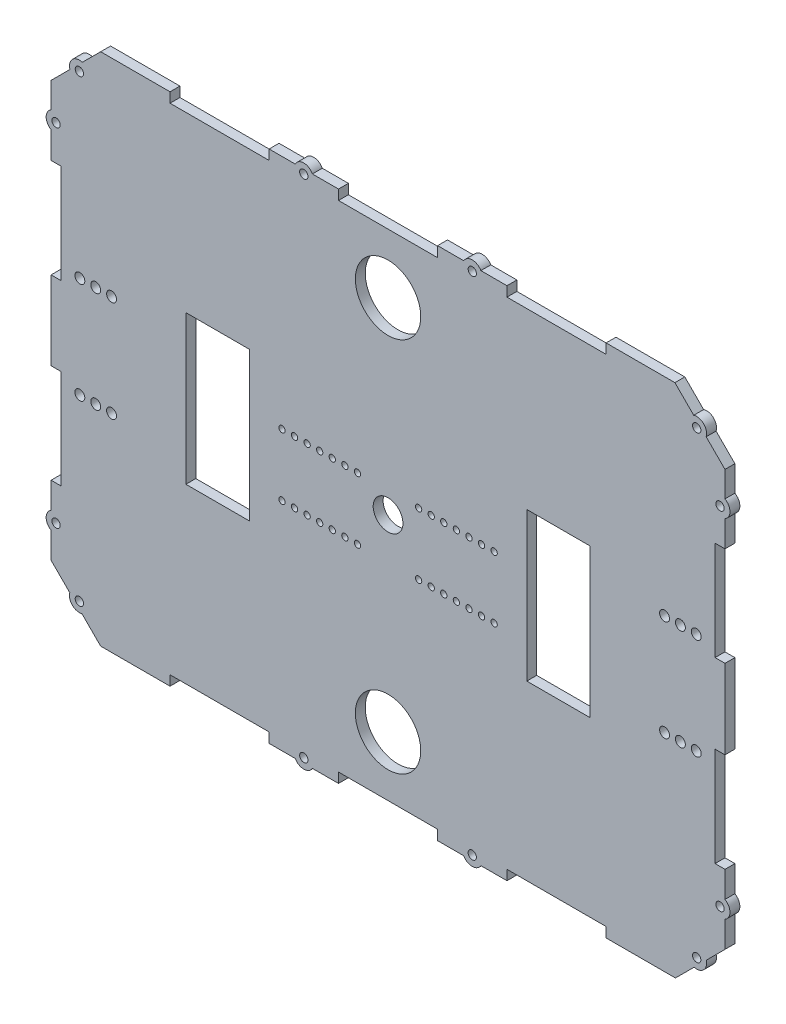
from build123d import *

# Parameters (mm, degrees)
ESQUISSE1_R        = 2.1
ESQUISSE1_R_2      = 2.5
ESQUISSE1_R_3      = 16.5
ESQUISSE1_R_4      = 7.5
ESQUISSE1_R_5      = 1.5875
ESQUISSE1_W        = 32
ESQUISSE1_H        = 75
BOSS_EXTRU_1_DEPTH = 5


with BuildPart() as part:
    # Esquisse1 → Boss.-Extru.1 (new body)
    with BuildSketch(Plane.XY):
        with BuildLine():
            Line((0, 0), (35, 0))
            Line((35, 0), (35, -5))
            Line((35, -5), (85, -5))
            Line((85, -5), (85, 0))
            Line((85, 0), (98.169872981, 0))
            ThreePointArc((98.169872981, 0), (102.5, 2.641471856), (106.830127019, 0))
            Line((106.830127019, 0), (120, 0))
            Line((120, 0), (120, -5))
            Line((120, -5), (170, -5))
            Line((170, -5), (170, 0.271578296))
            Line((170, 0.271578296), (183.169872981, 0.271578296))
            ThreePointArc((183.169872981, 0.271578296), (187.5, 2.771578296), (191.830127019, 0.271578296))
            Line((191.830127019, 0.271578296), (205, 0.271578296))
            Line((205, 0.271578296), (205, -4.728421704))
            Line((205, -4.728421704), (255, -4.728421704))
            Line((255, -4.728421704), (255, 0.271578296))
            Line((255, 0.271578296), (289.728421704, 0.271578296))
            Line((289.728421704, 0.271578296), (299.227867688, -9.227867688))
            ThreePointArc((299.227867688, -9.227867688), (304.267766953, -10.460654751), (305.500554016, -15.500554016))
            Line((305.500554016, -15.500554016), (315, -25))
            Line((315, -25), (315, -37.898294686))
            ThreePointArc((315, -37.898294686), (317.5, -42.228421704), (315, -46.558548723))
            Line((315, -46.558548723), (315, -59.728421704))
            Line((315, -59.728421704), (310, -59.728421704))
            Line((310, -59.728421704), (310, -109.728421704))
            Line((310, -109.728421704), (315, -109.728421704))
            Line((315, -109.728421704), (315, -149.728421704))
            Line((315, -149.728421704), (310, -149.728421704))
            Line((310, -149.728421704), (310, -199.728421704))
            Line((310, -199.728421704), (315, -199.728421704))
            Line((315, -199.728421704), (315, -212.898294686))
            ThreePointArc((315, -212.898294686), (317.5, -217.228421704), (315, -221.558548723))
            Line((315, -221.558548723), (315, -234.728421704))
            Line((315, -234.728421704), (305.561862178, -244.166559526))
            ThreePointArc((305.561862178, -244.166559526), (304.267766953, -248.996188657), (299.438137822, -250.290283883))
            Line((299.438137822, -250.290283883), (290, -259.728421704))
            Line((290, -259.728421704), (255, -259.728421704))
            Line((255, -259.728421704), (255, -254.728421704))
            Line((255, -254.728421704), (205, -254.728421704))
            Line((205, -254.728421704), (205, -259.728421704))
            Line((205, -259.728421704), (191.830127019, -259.728421704))
            ThreePointArc((191.830127019, -259.728421704), (187.5, -262.228421704), (183.169872981, -259.728421704))
            Line((183.169872981, -259.728421704), (170, -259.728421704))
            Line((170, -259.728421704), (170, -254.728421704))
            Line((170, -254.728421704), (120, -254.728421704))
            Line((120, -254.728421704), (120, -259.728421704))
            Line((120, -259.728421704), (106.830127019, -259.728421704))
            ThreePointArc((106.830127019, -259.728421704), (102.5, -262.228421704), (98.169872981, -259.728421704))
            Line((98.169872981, -259.728421704), (85, -259.728421704))
            Line((85, -259.728421704), (85, -254.728421704))
            Line((85, -254.728421704), (35, -254.728421704))
            Line((35, -254.728421704), (35, -259.728421704))
            Line((35, -259.728421704), (0, -259.728421704))
            Line((0, -259.728421704), (-9.438137822, -250.290283883))
            ThreePointArc((-9.438137822, -250.290283883), (-14.267766953, -248.996188657), (-15.561862178, -244.166559526))
            Line((-15.561862178, -244.166559526), (-25, -234.728421704))
            Line((-25, -234.728421704), (-25, -221.558548723))
            ThreePointArc((-25, -221.558548723), (-27.5, -217.228421704), (-25, -212.898294686))
            Line((-25, -212.898294686), (-25, -199.728421704))
            Line((-25, -199.728421704), (-20, -199.728421704))
            Line((-20, -199.728421704), (-20, -149.728421704))
            Line((-20, -149.728421704), (-25, -149.728421704))
            Line((-25, -149.728421704), (-25, -110))
            Line((-25, -110), (-20, -110))
            Line((-20, -110), (-20, -60))
            Line((-20, -60), (-25, -60))
            Line((-25, -60), (-25, -46.558548723))
            ThreePointArc((-25, -46.558548723), (-27.5, -42.228421704), (-25, -37.898294686))
            Line((-25, -37.898294686), (-25, -25))
            Line((-25, -25), (-15.500554016, -15.500554016))
            ThreePointArc((-15.500554016, -15.500554016), (-14.267766953, -10.460654751), (-9.227867688, -9.227867688))
            Line((-9.227867688, -9.227867688), (0, 0))
        make_face()
        with Locations((102.5, -257.228421704)):
            Circle(ESQUISSE1_R, mode=Mode.SUBTRACT)
        with Locations(Location((187.5, -257.228421704, 0), (0, 0, 180))):
            Circle(ESQUISSE1_R, mode=Mode.SUBTRACT)
        with Locations(Location((102.5, -2.228421704, 0), (0, 0, 180))):
            Circle(ESQUISSE1_R, mode=Mode.SUBTRACT)
        with Locations((187.5, -2.228421704)):
            Circle(ESQUISSE1_R, mode=Mode.SUBTRACT)
        with Locations((-10.732233047, -13.996188657)):
            Circle(ESQUISSE1_R, mode=Mode.SUBTRACT)
        with Locations(Location((300.732233047, -13.996188657, 0), (0, 0, 180))):
            Circle(ESQUISSE1_R, mode=Mode.SUBTRACT)
        with Locations((300.732233047, -245.460654751)):
            Circle(ESQUISSE1_R, mode=Mode.SUBTRACT)
        with Locations(Location((-10.732233047, -245.460654751, 0), (0, 0, 180))):
            Circle(ESQUISSE1_R, mode=Mode.SUBTRACT)
        with Locations((-22.5, -217.228421704)):
            Circle(ESQUISSE1_R, mode=Mode.SUBTRACT)
        with Locations(Location((-22.5, -42.228421704, 0), (0, 0, 180))):
            Circle(ESQUISSE1_R, mode=Mode.SUBTRACT)
        with Locations((312.5, -42.228421704)):
            Circle(ESQUISSE1_R, mode=Mode.SUBTRACT)
        with Locations(Location((312.5, -217.228421704, 0), (0, 0, 180))):
            Circle(ESQUISSE1_R, mode=Mode.SUBTRACT)
        with Locations(Location((300.5, -155.228421704, 0), (0, 0, 180))):
            Circle(ESQUISSE1_R_2, mode=Mode.SUBTRACT)
        with Locations(Location((300.5, -104.228421704, 0), (0, 0, 180))):
            Circle(ESQUISSE1_R_2, mode=Mode.SUBTRACT)
        with Locations((145, -35)):
            Circle(ESQUISSE1_R_3, mode=Mode.SUBTRACT)
        with Locations((145, -129.864210852)):
            Circle(ESQUISSE1_R_4, mode=Mode.SUBTRACT)
        with Locations(Location((292.5, -104.228421704, 0), (0, 0, 180))):
            Circle(ESQUISSE1_R_2, mode=Mode.SUBTRACT)
        with Locations(Location((292.5, -155.228421704, 0), (0, 0, 180))):
            Circle(ESQUISSE1_R_2, mode=Mode.SUBTRACT)
        with Locations(Location((284.5, -104.228421704, 0), (0, 0, 180))):
            Circle(ESQUISSE1_R_2, mode=Mode.SUBTRACT)
        with Locations(Location((284.5, -155.228421704, 0), (0, 0, 180))):
            Circle(ESQUISSE1_R_2, mode=Mode.SUBTRACT)
        with Locations((-10.5, -104.228421704)):
            Circle(ESQUISSE1_R_2, mode=Mode.SUBTRACT)
        with Locations((-2.5, -104.228421704)):
            Circle(ESQUISSE1_R_2, mode=Mode.SUBTRACT)
        with Locations((5.5, -104.228421704)):
            Circle(ESQUISSE1_R_2, mode=Mode.SUBTRACT)
        with Locations((-10.5, -155.228421704)):
            Circle(ESQUISSE1_R_2, mode=Mode.SUBTRACT)
        with Locations((-2.5, -155.228421704)):
            Circle(ESQUISSE1_R_2, mode=Mode.SUBTRACT)
        with Locations((5.5, -155.228421704)):
            Circle(ESQUISSE1_R_2, mode=Mode.SUBTRACT)
        with Locations(Location((145, -224.728421704, 0), (0, 0, 180))):
            Circle(ESQUISSE1_R_3, mode=Mode.SUBTRACT)
        with Locations((91.471682341, -119.185385667)):
            Circle(ESQUISSE1_R_5, mode=Mode.SUBTRACT)
        with Locations((104.171682341, -119.185385667)):
            Circle(ESQUISSE1_R_5, mode=Mode.SUBTRACT)
        with Locations((97.821682341, -119.185385667)):
            Circle(ESQUISSE1_R_5, mode=Mode.SUBTRACT)
        with Locations((110.521682341, -119.185385667)):
            Circle(ESQUISSE1_R_5, mode=Mode.SUBTRACT)
        with Locations((116.871682341, -119.185385667)):
            Circle(ESQUISSE1_R_5, mode=Mode.SUBTRACT)
        with Locations((129.571682341, -119.185385667)):
            Circle(ESQUISSE1_R_5, mode=Mode.SUBTRACT)
        with Locations((123.221682341, -119.185385667)):
            Circle(ESQUISSE1_R_5, mode=Mode.SUBTRACT)
        with Locations((129.571682341, -150.427385667)):
            Circle(ESQUISSE1_R_5, mode=Mode.SUBTRACT)
        with Locations((123.221682341, -150.427385667)):
            Circle(ESQUISSE1_R_5, mode=Mode.SUBTRACT)
        with Locations((116.871682341, -150.427385667)):
            Circle(ESQUISSE1_R_5, mode=Mode.SUBTRACT)
        with Locations((110.521682341, -150.427385667)):
            Circle(ESQUISSE1_R_5, mode=Mode.SUBTRACT)
        with Locations((104.171682341, -150.427385667)):
            Circle(ESQUISSE1_R_5, mode=Mode.SUBTRACT)
        with Locations((97.821682341, -150.427385667)):
            Circle(ESQUISSE1_R_5, mode=Mode.SUBTRACT)
        with Locations((91.471682341, -150.427385667)):
            Circle(ESQUISSE1_R_5, mode=Mode.SUBTRACT)
        with Locations(Location((198.528317659, -119.185385667, 0), (0, 0, 180))):
            Circle(ESQUISSE1_R_5, mode=Mode.SUBTRACT)
        with Locations(Location((192.178317659, -119.185385667, 0), (0, 0, 180))):
            Circle(ESQUISSE1_R_5, mode=Mode.SUBTRACT)
        with Locations(Location((185.828317659, -119.185385667, 0), (0, 0, 180))):
            Circle(ESQUISSE1_R_5, mode=Mode.SUBTRACT)
        with Locations(Location((179.478317659, -119.185385667, 0), (0, 0, 180))):
            Circle(ESQUISSE1_R_5, mode=Mode.SUBTRACT)
        with Locations(Location((173.128317659, -119.185385667, 0), (0, 0, 180))):
            Circle(ESQUISSE1_R_5, mode=Mode.SUBTRACT)
        with Locations(Location((166.778317659, -119.185385667, 0), (0, 0, 180))):
            Circle(ESQUISSE1_R_5, mode=Mode.SUBTRACT)
        with Locations(Location((160.428317659, -119.185385667, 0), (0, 0, 180))):
            Circle(ESQUISSE1_R_5, mode=Mode.SUBTRACT)
        with Locations(Location((160.428317659, -150.427385667, 0), (0, 0, 180))):
            Circle(ESQUISSE1_R_5, mode=Mode.SUBTRACT)
        with Locations(Location((166.778317659, -150.427385667, 0), (0, 0, 180))):
            Circle(ESQUISSE1_R_5, mode=Mode.SUBTRACT)
        with Locations(Location((173.128317659, -150.427385667, 0), (0, 0, 180))):
            Circle(ESQUISSE1_R_5, mode=Mode.SUBTRACT)
        with Locations(Location((179.478317659, -150.427385667, 0), (0, 0, 180))):
            Circle(ESQUISSE1_R_5, mode=Mode.SUBTRACT)
        with Locations(Location((185.828317659, -150.427385667, 0), (0, 0, 180))):
            Circle(ESQUISSE1_R_5, mode=Mode.SUBTRACT)
        with Locations(Location((192.178317659, -150.427385667, 0), (0, 0, 180))):
            Circle(ESQUISSE1_R_5, mode=Mode.SUBTRACT)
        with Locations(Location((198.528317659, -150.427385667, 0), (0, 0, 180))):
            Circle(ESQUISSE1_R_5, mode=Mode.SUBTRACT)
        with Locations((231, -130)):
            Rectangle(ESQUISSE1_W, ESQUISSE1_H, mode=Mode.SUBTRACT)
        with Locations((59, -130)):
            Rectangle(ESQUISSE1_W, ESQUISSE1_H, mode=Mode.SUBTRACT)
    extrude(amount=BOSS_EXTRU_1_DEPTH)


solid = part.part
